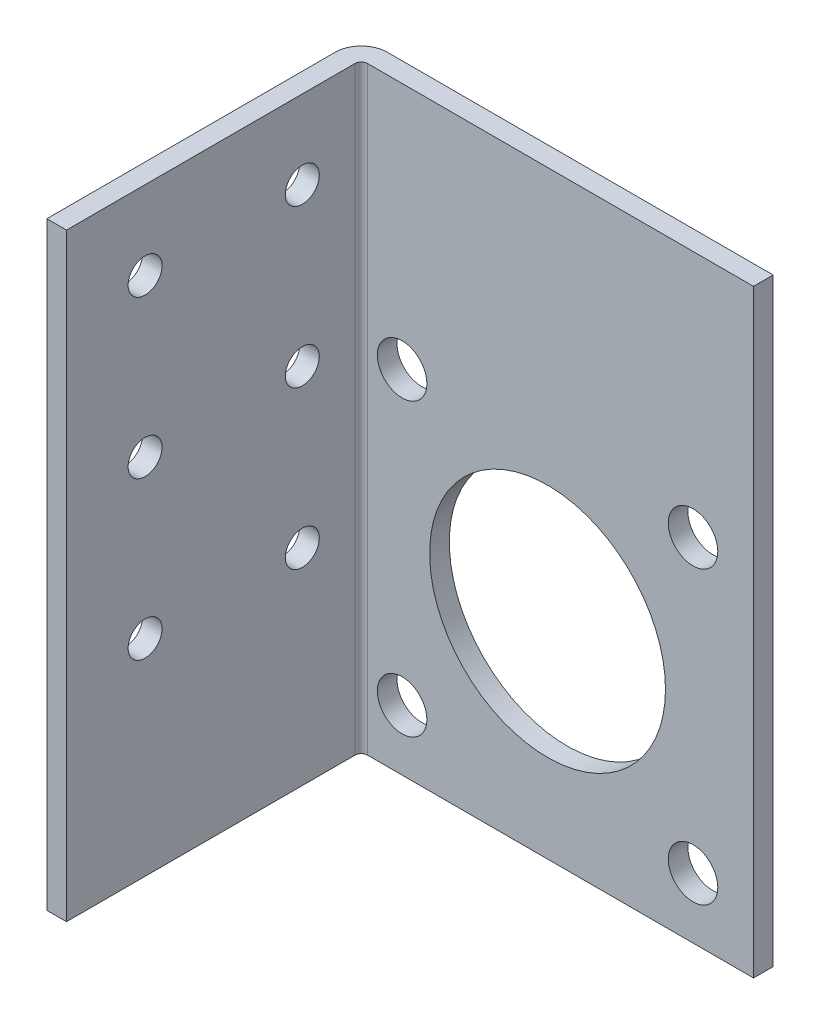
from build123d import *

# Parameters (mm, degrees)
SKETCH1_W           = 66.548
SKETCH1_H           = 96.774
SKETCH1_R           = 19.05
SKETCH1_R_2         = 4
BOSS_EXTRUDE3_DEPTH = 3.175
SKETCH3_W           = 50.8
SKETCH3_H           = 96.774
SKETCH3_R           = 2.7432
BOSS_EXTRUDE4_DEPTH = 3.175
FILLET2_R           = 1.016
FILLET3_R           = 4.191


with BuildPart() as part:
    # Sketch1 → Boss-Extrude3 (new body)
    with BuildSketch(Plane.XY):
        with Locations((0, 15.113)):
            Rectangle(SKETCH1_W, SKETCH1_H)
        Circle(SKETCH1_R, mode=Mode.SUBTRACT)
        with Locations((23.5, 23.5)):
            Circle(SKETCH1_R_2, mode=Mode.SUBTRACT)
        with Locations((23.5, -23.5)):
            Circle(SKETCH1_R_2, mode=Mode.SUBTRACT)
        with Locations((-23.5, -23.5)):
            Circle(SKETCH1_R_2, mode=Mode.SUBTRACT)
        with Locations((-23.5, 23.5)):
            Circle(SKETCH1_R_2, mode=Mode.SUBTRACT)
    extrude(amount=BOSS_EXTRUDE3_DEPTH)

    # Sketch3 → Boss-Extrude4 (add)
    with BuildSketch(Plane.ZY.offset(33.274)):
        with Locations((25.4, 15.113)):
            Rectangle(SKETCH3_W, SKETCH3_H)
        with Locations(Location((38.1, 50.8, 0), (0, 0, 270))):
            Circle(SKETCH3_R, mode=Mode.SUBTRACT)
        with Locations(Location((12.7, 50.8, 0), (0, 0, 270))):
            Circle(SKETCH3_R, mode=Mode.SUBTRACT)
        with Locations(Location((38.1, 25.4, 0), (0, 0, 270))):
            Circle(SKETCH3_R, mode=Mode.SUBTRACT)
        with Locations(Location((12.7, 25.4, 0), (0, 0, 270))):
            Circle(SKETCH3_R, mode=Mode.SUBTRACT)
        with Locations(Location((38.1, 0, 0), (0, 0, 270))):
            Circle(SKETCH3_R, mode=Mode.SUBTRACT)
        with Locations(Location((12.7, 0, 0), (0, 0, 270))):
            Circle(SKETCH3_R, mode=Mode.SUBTRACT)
    extrude(amount=-BOSS_EXTRUDE4_DEPTH)

    # Fillet2
    fillet2_edges = [part.edges().sort_by_distance(p)[0] for p in [
        (-30.099, 15.113, 3.175),
    ]]
    fillet(fillet2_edges, radius=FILLET2_R)

    # Fillet3
    fillet3_edges = [part.edges().sort_by_distance(p)[0] for p in [
        (-33.274, 15.113, 0),
    ]]
    fillet(fillet3_edges, radius=FILLET3_R)


solid = part.part
